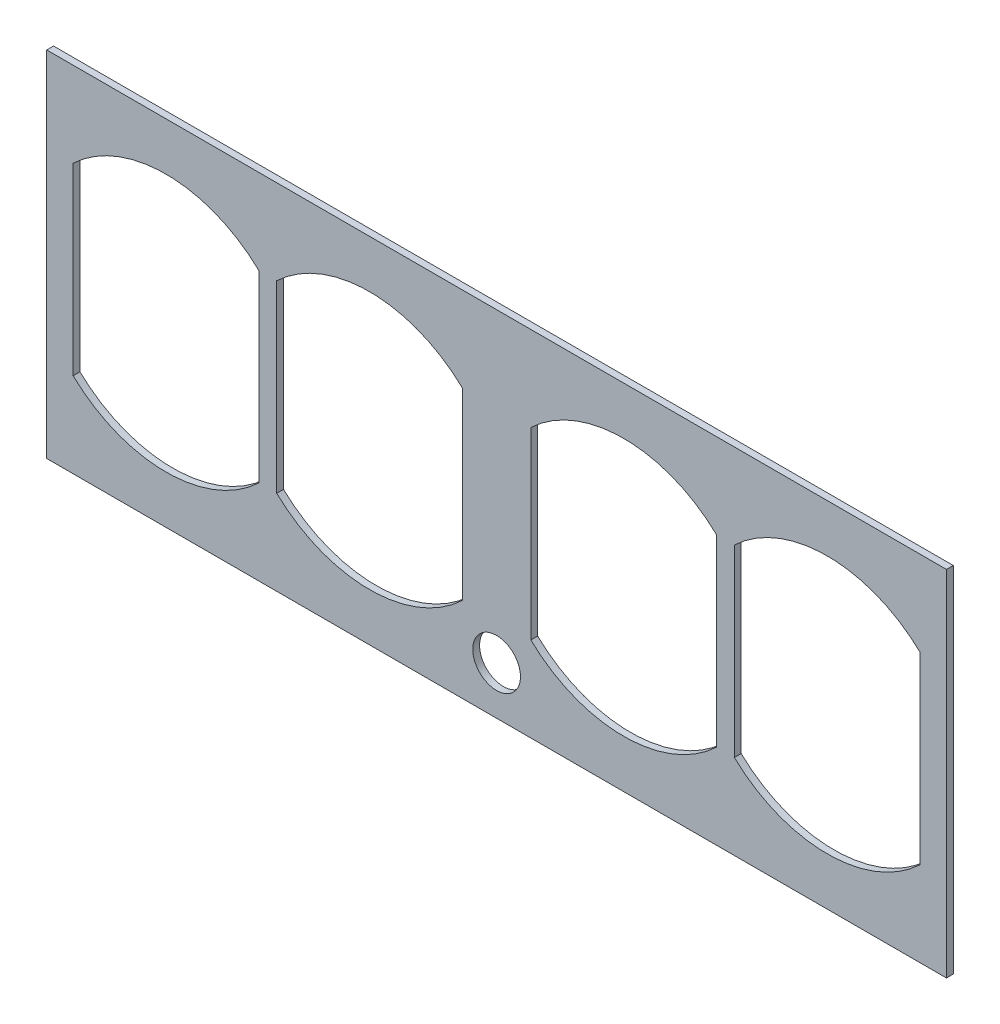
from build123d import *

# Parameters (mm, degrees)
SKETCH_1_W      = 105.64042879
SKETCH_1_H      = 41.546296754
SKETCH_1_R      = 2.8
EXTRUDE_2_DEPTH = 0.8


with BuildPart() as part:
    # Эскиз1 → Бобышка-Вытянуть2 (new body)
    with BuildSketch(Plane.XY):
        with Locations((0.083446622, -0.02774538)):
            Rectangle(SKETCH_1_W, SKETCH_1_H)
        with Locations((0.083446622, -15.17774538)):
            Circle(SKETCH_1_R, mode=Mode.SUBTRACT)
        with BuildLine():
            Line((-49.635877413, 10.77725462), (-49.635877413, -10.83274538))
            ThreePointArc((-49.635877413, -10.83274538), (-38.735877413, -15.17774538), (-27.835877413, -10.83274538))
            Line((-27.835877413, -10.83274538), (-27.835877413, 10.77725462))
            ThreePointArc((-27.835877413, 10.77725462), (-38.735877413, 15.12225462), (-49.635877413, 10.77725462))
        make_face(mode=Mode.SUBTRACT)
        with BuildLine():
            Line((-25.735877413, 10.77725462), (-25.735877413, -10.83274538))
            ThreePointArc((-25.735877413, -10.83274538), (-14.835877413, -15.17774538), (-3.935877413, -10.83274538))
            Line((-3.935877413, -10.83274538), (-3.935877413, 10.77725462))
            ThreePointArc((-3.935877413, 10.77725462), (-14.835877413, 15.12225462), (-25.735877413, 10.77725462))
        make_face(mode=Mode.SUBTRACT)
        with BuildLine():
            Line((4.102770658, 10.77725462), (4.102770658, -10.83274538))
            ThreePointArc((4.102770658, -10.83274538), (15.002770658, -15.17774538), (25.902770658, -10.83274538))
            Line((25.902770658, -10.83274538), (25.902770658, 10.77725462))
            ThreePointArc((25.902770658, 10.77725462), (15.002770658, 15.12225462), (4.102770658, 10.77725462))
        make_face(mode=Mode.SUBTRACT)
        with BuildLine():
            Line((28.002770658, 10.77725462), (28.002770658, -10.83274538))
            ThreePointArc((28.002770658, -10.83274538), (38.902770658, -15.17774538), (49.802770658, -10.83274538))
            Line((49.802770658, -10.83274538), (49.802770658, 10.77725462))
            ThreePointArc((49.802770658, 10.77725462), (38.902770658, 15.12225462), (28.002770658, 10.77725462))
        make_face(mode=Mode.SUBTRACT)
    extrude(amount=EXTRUDE_2_DEPTH)


solid = part.part
